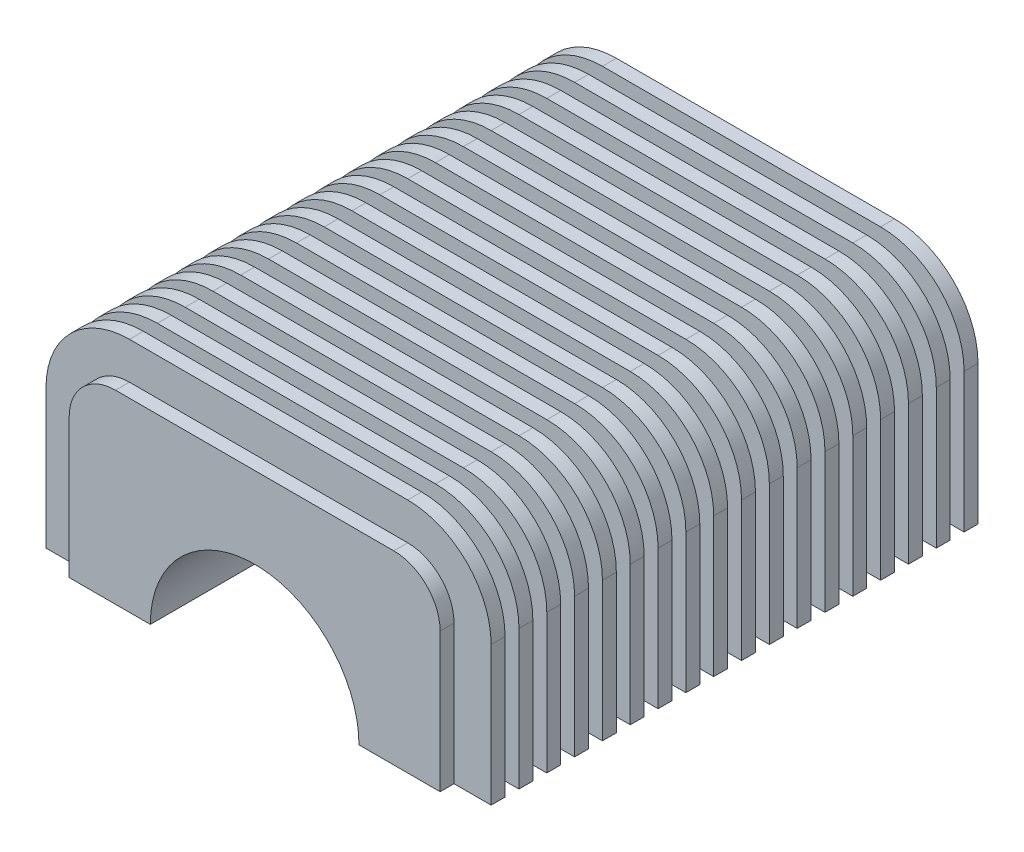
from build123d import *

# Parameters (mm, degrees)
DODANIE_WYCI_GNI_CIE1_DEPTH = 108
ZAOKR_GLENIE1_R             = 10
DODANIE_WYCI_GNI_CIE2_DEPTH = 3
SZYK_LINIOWY1_COUNT         = 18
SZYK_LINIOWY1_PITCH         = 6


with BuildPart() as part:
    # Szkic1 → Dodanie-wyciągnięcie1 (new body)
    with BuildSketch(Plane.XY):
        with BuildLine():
            Line((-40, 40), (-40, 0))
            Line((-40, 0), (-22.5, 0))
            ThreePointArc((-22.5, 0), (0, 22.5), (22.5, 0))
            Line((22.5, 0), (40, 0))
            Line((40, 0), (40, 40))
            Line((40, 40), (-40, 40))
        make_face()
    extrude(amount=DODANIE_WYCI_GNI_CIE1_DEPTH)

    # Zaokrąglenie1
    zaokr_glenie1_edges = [part.edges().sort_by_distance(p)[0] for p in [
        (-40, 40, 54),
        (40, 40, 54),
    ]]
    fillet(zaokr_glenie1_edges, radius=ZAOKR_GLENIE1_R)

    # Szkic3 → Dodanie-wyciągnięcie2 (add)
    with BuildSketch(Plane(origin=(0, 0, 0), x_dir=(-1, 0, 0), z_dir=(0, 0, -1))):
        with BuildLine():
            Line((48, 0), (40, 0))
            Line((40, 0), (22.5, 0))
            ThreePointArc((22.5, 0), (0, 22.5), (-22.5, 0))
            Line((-22.5, 0), (-40, 0))
            Line((-40, 0), (-48, 0))
            Line((-48, 0), (-48, 30))
            ThreePointArc((-48, 30), (-42.727922061, 42.727922061), (-30, 48))
            Line((-30, 48), (30, 48))
            ThreePointArc((30, 48), (42.727922061, 42.727922061), (48, 30))
            Line((48, 30), (48, 0))
        make_face()
    dodanie_wyci_gni_cie2 = extrude(amount=-DODANIE_WYCI_GNI_CIE2_DEPTH)

    # Szyk liniowy1: Dodanie-wyciągnięcie2 ×18
    with Locations(*[(0, 0, i * SZYK_LINIOWY1_PITCH) for i in range(1, SZYK_LINIOWY1_COUNT)]):
        add(dodanie_wyci_gni_cie2)


solid = part.part
